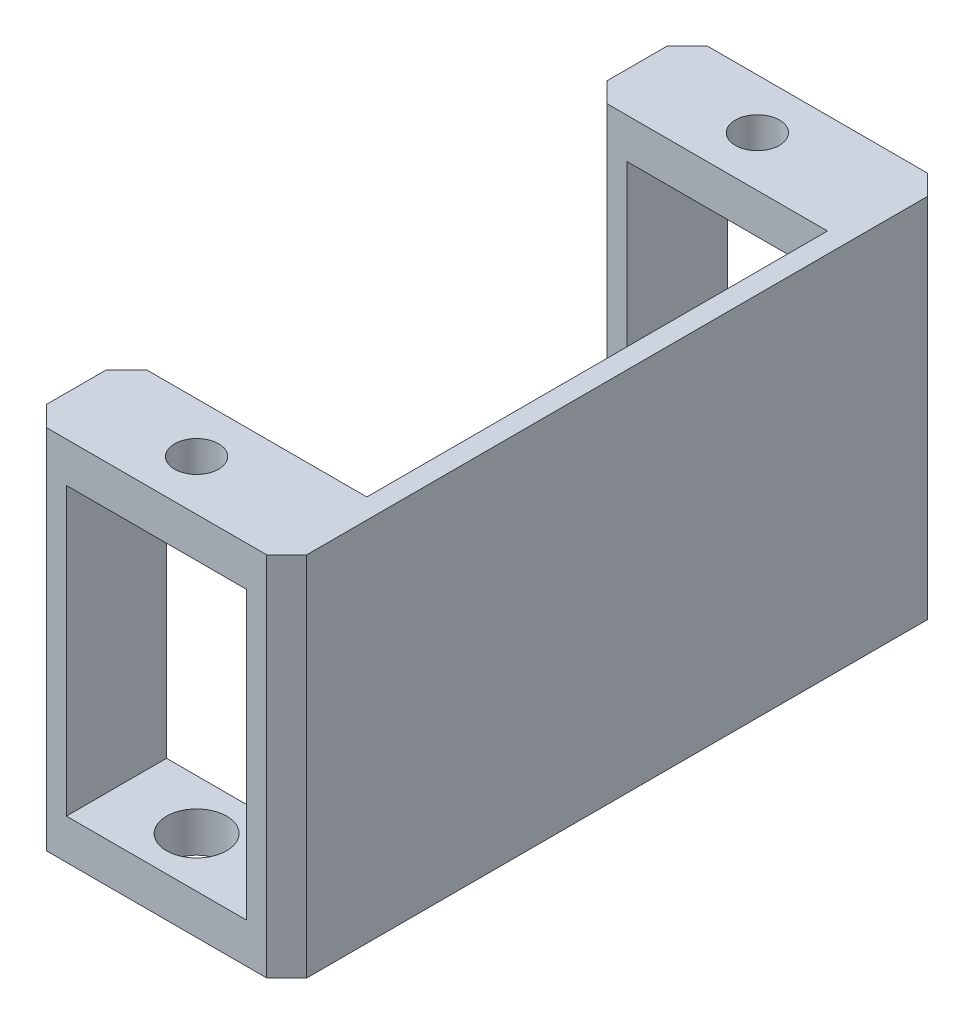
from build123d import *

# Parameters (mm, degrees)
BOSS_EXTRUDE1_DEPTH = 2
CUT_EXTRUDE1_REACH  = 20.035
SKETCH2_R           = 1.5
SKETCH3_W           = 2
SKETCH3_H           = 5
BOSS_EXTRUDE2_DEPTH = 14.3
BOSS_EXTRUDE3_DEPTH = 2
CUT_EXTRUDE2_REACH  = 27.615
SKETCH5_R           = 1.1
CHAMFER1_SIZE       = 1


with BuildPart() as part:
    # Sketch1 → Boss-Extrude1 (new body)
    with BuildSketch(Plane(origin=(0, 0, 0), x_dir=(1, 0, 0), z_dir=(0, 1, 0))):
        Polygon((-6, -16.5), (6, -16.5), (7, -16.5), (7, 16.5), (6, 16.5), (-6, 16.5), (-6, 11.5), (6, 11.5), (6, -11.5), (-6, -11.5), align=None)
    extrude(amount=BOSS_EXTRUDE1_DEPTH)

    # Sketch2 → Cut-Extrude1 (cut, up to next)
    with BuildSketch(Plane(origin=(0, 2, 0), x_dir=(1, 0, 0), z_dir=(0, 1, 0)), mode=Mode.PRIVATE) as cut_extrude1_sk1:
        with Locations(Location((0, -14, 0), (0, 0, 270))):
            Circle(SKETCH2_R)
    cut_extrude1_tool1 = extrude(cut_extrude1_sk1.sketch, amount=-CUT_EXTRUDE1_REACH, mode=Mode.PRIVATE) & part.part
    # Sketch2 → Cut-Extrude1 (cut, up to next)
    with BuildSketch(Plane(origin=(0, 2, 0), x_dir=(1, 0, 0), z_dir=(0, 1, 0)), mode=Mode.PRIVATE) as cut_extrude1_sk2:
        with Locations(Location((0, 14, 0), (0, 0, 270))):
            Circle(SKETCH2_R)
    cut_extrude1_tool2 = extrude(cut_extrude1_sk2.sketch, amount=-CUT_EXTRUDE1_REACH, mode=Mode.PRIVATE) & part.part
    add(cut_extrude1_tool1.solids().sort_by_distance((0, 2, 14))[0], mode=Mode.SUBTRACT)
    add(cut_extrude1_tool2.solids().sort_by_distance((0, 2, -14))[0], mode=Mode.SUBTRACT)

    # Sketch3 → Boss-Extrude2 (add)
    with BuildSketch(Plane(origin=(0, 2, 0), x_dir=(1, 0, 0), z_dir=(0, 1, 0))):
        with Locations((-5, 14)):
            Rectangle(SKETCH3_W, SKETCH3_H)
        Polygon((7, 16.5), (5, 16.5), (5, 11.5), (6, 11.5), (6, -11.5), (5, -11.5), (5, -16.5), (7, -16.5), (7, -11.5), (7, 11.5), align=None)
        with Locations((-5, -14)):
            Rectangle(SKETCH3_W, SKETCH3_H)
    extrude(amount=BOSS_EXTRUDE2_DEPTH)

    # Sketch4 → Boss-Extrude3 (add)
    with BuildSketch(Plane(origin=(0, 16.3, 0), x_dir=(1, 0, 0), z_dir=(0, 1, 0))):
        Polygon((6, 11.5), (6, -11.5), (-6, -11.5), (-6, -16.5), (7, -16.5), (7, 16.5), (-6, 16.5), (-6, 11.5), align=None)
    extrude(amount=BOSS_EXTRUDE3_DEPTH)

    # Sketch5 → Cut-Extrude2 (cut, up to next)
    with BuildSketch(Plane(origin=(0, 18.3, 0), x_dir=(1, 0, 0), z_dir=(0, 1, 0)), mode=Mode.PRIVATE) as cut_extrude2_sk1:
        with Locations(Location((0, 14, 0), (0, 0, 270))):
            Circle(SKETCH5_R)
    cut_extrude2_tool1 = extrude(cut_extrude2_sk1.sketch, amount=-CUT_EXTRUDE2_REACH, mode=Mode.PRIVATE) & part.part
    # Sketch5 → Cut-Extrude2 (cut, up to next)
    with BuildSketch(Plane(origin=(0, 18.3, 0), x_dir=(1, 0, 0), z_dir=(0, 1, 0)), mode=Mode.PRIVATE) as cut_extrude2_sk2:
        with Locations(Location((0, -14, 0), (0, 0, 270))):
            Circle(SKETCH5_R)
    cut_extrude2_tool2 = extrude(cut_extrude2_sk2.sketch, amount=-CUT_EXTRUDE2_REACH, mode=Mode.PRIVATE) & part.part
    add(cut_extrude2_tool1.solids().sort_by_distance((0, 18.3, -14))[0], mode=Mode.SUBTRACT)
    add(cut_extrude2_tool2.solids().sort_by_distance((0, 18.3, 14))[0], mode=Mode.SUBTRACT)

    # Chamfer1
    chamfer1_edges = [part.edges().sort_by_distance(p)[0] for p in [
        (-6, 9.15, -11.5),
        (-6, 9.15, -16.5),
        (7, 9.15, -16.5),
        (7, 9.15, 16.5),
        (-6, 9.15, 16.5),
        (-6, 9.15, 11.5),
    ]]
    chamfer(chamfer1_edges, length=CHAMFER1_SIZE)


solid = part.part
